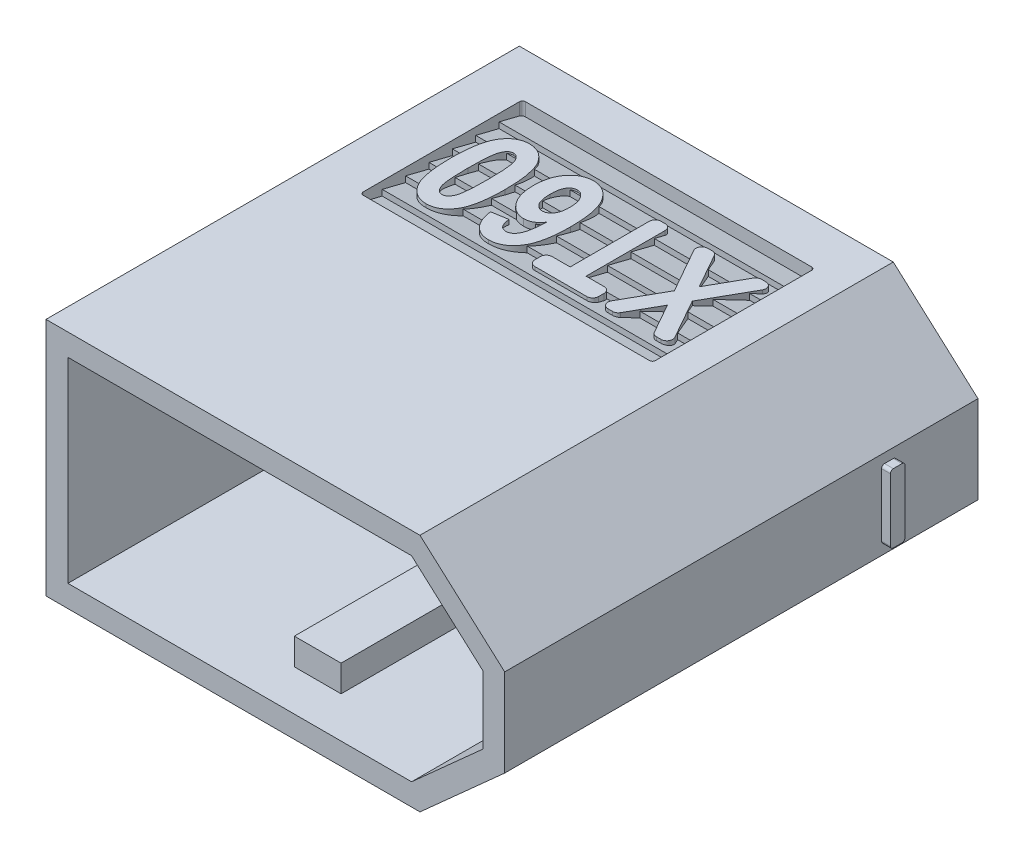
from build123d import *

# Parameters (mm, degrees)
RESSALTO_EXTRUS_O1_DEPTH = 16.2
CORTE_EXTRUS_O1_DEPTH    = 9.4
ESBO_O3_W                = 1.6
ESBO_O3_H                = 0.91
RESSALTO_EXTRUS_O2_DEPTH = 8
ESBO_O4_W                = 1.6
ESBO_O4_H                = 4.7
CORTE_EXTRUS_O2_DEPTH    = 1.5
ESBO_O5_R                = 3
CORTE_EXTRUS_O3_DEPTH    = 2
ESBO_O6_R                = 2.15
CORTE_EXTRUS_O4_DEPTH    = 23.701762046
RESSALTO_EXTRUS_O3_DEPTH = 0.3
RESSALTO_EXTRUS_O4_DEPTH = 0.3
CORTE_EXTRUS_O5_DEPTH    = 0.75
RESSALTO_EXTRUS_O7_REACH = 25.143
RESSALTO_EXTRUS_O8_DEPTH = 0.3
RESSALTO_EXTRUS_O9_DEPTH = 0.3


with BuildPart() as part:
    # Esboço1 → Ressalto-extrusão1 (new body)
    with BuildSketch(Plane.XY):
        Polygon((0, 0), (12.8, 0), (15.7, 2.6), (15.7, 5.6), (12.8, 8.2), (0, 8.2), align=None)
    extrude(amount=RESSALTO_EXTRUS_O1_DEPTH)

    # Esboço2 → Corte-extrusão1 (cut)
    with BuildSketch(Plane.XY.offset(16.2)):
        Polygon((0.75, 7.45), (0.75, 0.75), (12.513018725, 0.75), (14.95, 2.934879763), (14.95, 5.265120237), (12.513018725, 7.45), align=None)
    extrude(amount=-CORTE_EXTRUS_O1_DEPTH, mode=Mode.SUBTRACT)

    # Esboço3 → Ressalto-extrusão2 (add)
    with BuildSketch(Plane.XY.offset(6.8)):
        with Locations((7.9, 1.205)):
            Rectangle(ESBO_O3_W, ESBO_O3_H)
    extrude(amount=RESSALTO_EXTRUS_O2_DEPTH)

    # Esboço4 → Corte-extrusão2 (cut)
    with BuildSketch(Plane.XY.offset(6.8)):
        with Locations((7.9, 4.1)):
            Rectangle(ESBO_O4_W, ESBO_O4_H)
    extrude(amount=-CORTE_EXTRUS_O2_DEPTH, mode=Mode.SUBTRACT)

    # Esboço5 → Corte-extrusão3 (cut)
    with BuildSketch(Plane(origin=(0, 0, 0), x_dir=(-1, 0, 0), z_dir=(0, 0, -1))):
        with Locations((-11.35, 4.1)):
            Circle(ESBO_O5_R)
        with Locations((-4.25, 4.1)):
            Circle(ESBO_O5_R)
    extrude(amount=-CORTE_EXTRUS_O3_DEPTH, mode=Mode.SUBTRACT)

    # Esboço6 → Corte-extrusão4 (cut, through all)
    with BuildSketch(Plane(origin=(0, 0, 2), x_dir=(-1, 0, 0), z_dir=(0, 0, -1))):
        with Locations((-11.35, 4.1)):
            Circle(ESBO_O6_R)
        with Locations((-4.25, 4.1)):
            Circle(ESBO_O6_R)
    extrude(amount=-CORTE_EXTRUS_O4_DEPTH, mode=Mode.SUBTRACT)

    # Esboço7 → Ressalto-extrusão3 (add)
    with BuildSketch(Plane.ZY):
        with BuildLine():
            Line((2.8, 4.35), (2.05, 4.35))
            ThreePointArc((2.05, 4.35), (1.979289322, 4.320710678), (1.95, 4.25))
            Line((1.95, 4.25), (1.95, 3.95))
            ThreePointArc((1.95, 3.95), (1.979289322, 3.879289322), (2.05, 3.85))
            Line((2.05, 3.85), (2.8, 3.85))
            ThreePointArc((2.8, 3.85), (2.870710678, 3.820710678), (2.9, 3.75))
            Line((2.9, 3.75), (2.9, 3))
            ThreePointArc((2.9, 3), (2.929289322, 2.929289322), (3, 2.9))
            Line((3, 2.9), (3.3, 2.9))
            ThreePointArc((3.3, 2.9), (3.370710678, 2.929289322), (3.4, 3))
            Line((3.4, 3), (3.4, 3.75))
            ThreePointArc((3.4, 3.75), (3.429289322, 3.820710678), (3.5, 3.85))
            Line((3.5, 3.85), (4.25, 3.85))
            ThreePointArc((4.25, 3.85), (4.320710678, 3.879289322), (4.35, 3.95))
            Line((4.35, 3.95), (4.35, 4.25))
            ThreePointArc((4.35, 4.25), (4.320710678, 4.320710678), (4.25, 4.35))
            Line((4.25, 4.35), (3.5, 4.35))
            ThreePointArc((3.5, 4.35), (3.429289322, 4.379289322), (3.4, 4.45))
            Line((3.4, 4.45), (3.4, 5.2))
            ThreePointArc((3.4, 5.2), (3.370710678, 5.270710678), (3.3, 5.3))
            Line((3.3, 5.3), (3, 5.3))
            ThreePointArc((3, 5.3), (2.929289322, 5.270710678), (2.9, 5.2))
            Line((2.9, 5.2), (2.9, 4.45))
            ThreePointArc((2.9, 4.45), (2.870710678, 4.379289322), (2.8, 4.35))
        make_face()
    extrude(amount=RESSALTO_EXTRUS_O3_DEPTH)

    # Esboço8 → Ressalto-extrusão4 (add)
    with BuildSketch(Plane(origin=(15.7, 0, 0), x_dir=(0, 0, -1), z_dir=(1, 0, 0))):
        with BuildLine():
            Line((-3.2, 2.925), (-2.9, 2.925))
            ThreePointArc((-2.9, 2.925), (-2.829289322, 2.954289322), (-2.8, 3.025))
            Line((-2.8, 3.025), (-2.8, 5.175))
            ThreePointArc((-2.8, 5.175), (-2.829289322, 5.245710678), (-2.9, 5.275))
            Line((-2.9, 5.275), (-3.2, 5.275))
            ThreePointArc((-3.2, 5.275), (-3.270710678, 5.245710678), (-3.3, 5.175))
            Line((-3.3, 5.175), (-3.3, 3.025))
            ThreePointArc((-3.3, 3.025), (-3.270710678, 2.954289322), (-3.2, 2.925))
        make_face()
    extrude(amount=RESSALTO_EXTRUS_O4_DEPTH)

    # Esboço9 → Corte-extrusão5 (cut)
    with BuildSketch(Plane.XZ):
        with BuildLine():
            Line((1.75, 7.093123445), (11.55, 7.093123445))
            ThreePointArc((11.55, 7.093123445), (11.620710678, 7.063834123), (11.65, 6.993123445))
            Line((11.65, 6.993123445), (11.65, 1.643123445))
            ThreePointArc((11.65, 1.643123445), (11.620710678, 1.572412766), (11.55, 1.543123445))
            Line((11.55, 1.543123445), (1.75, 1.543123445))
            ThreePointArc((1.75, 1.543123445), (1.679289322, 1.572412766), (1.65, 1.643123445))
            Line((1.65, 1.643123445), (1.65, 6.993123445))
            ThreePointArc((1.65, 6.993123445), (1.679289322, 7.063834123), (1.75, 7.093123445))
        make_face()
    corte_extrus_o5 = extrude(amount=-CORTE_EXTRUS_O5_DEPTH, mode=Mode.SUBTRACT)

    # Ressalto-extrusão7: up to this face of the body (flat: up to its plane)
    ressalto_extrus_o7_end = Plane(part.part.faces().sort_by_distance((11.65, 0.375, 4.318123445))[0])
    # Esboço10 → Ressalto-extrusão7 (add, up to the picked face)
    with BuildSketch(Plane(origin=(1.65, 0, 0), x_dir=(0, 0, -1), z_dir=(1, 0, 0)), mode=Mode.PRIVATE) as ressalto_extrus_o7_sk1:
        Polygon((-3.143123445, 0.45), (-3.143123445, 0.25), (-2.343123445, 0.45), (-2.343123445, 0.25), (-1.543123445, 0.45), (-1.543123445, 0.75), (-7.143123445, 0.75), (-7.143123445, 0.45), (-7.143123445, 0.25), (-6.343123445, 0.45), (-6.343123445, 0.25), (-5.543123445, 0.45), (-5.543123445, 0.25), (-4.743123445, 0.45), (-4.743123445, 0.25), (-3.943123445, 0.45), (-3.943123445, 0.25), align=None)
    ressalto_extrus_o7_tool1 = split(extrude(ressalto_extrus_o7_sk1.sketch, amount=RESSALTO_EXTRUS_O7_REACH, mode=Mode.PRIVATE), bisect_by=ressalto_extrus_o7_end, keep=Keep.BOTH, mode=Mode.PRIVATE)
    ressalto_extrus_o7 = ressalto_extrus_o7_tool1.solids().sort_by(Axis((1.65, 0.545833, 4.376457), (1, 0, 0)))[0]
    add(ressalto_extrus_o7)

    # Espelhar1: Corte-extrusão5, Ressalto-extrusão7 across plane
    add(corte_extrus_o5.mirror(Plane.ZX.offset(4.1)), mode=Mode.SUBTRACT)
    add(ressalto_extrus_o7.mirror(Plane.ZX.offset(4.1)))

    # Esboço11 → Ressalto-extrusão8 (add)
    with BuildSketch(Plane(origin=(0, 0.5, 0), x_dir=(-1, 0, 0), z_dir=(0, -1, 0))):
        with BuildLine():
            add(Edge.make_bspline(
                [(-5.023961169, -6.00435038), (-5.023731287, -5.995665006), (-5.023167139, -5.974350412), (-5.020606597, -5.937326865), (-5.015634685, -5.891913541), (-5.008374694, -5.840781928), (-4.996852924, -5.786628833), (-4.98507998, -5.730621834), (-4.970342979, -5.676032154), (-4.952923205, -5.625615372), (-4.932961076, -5.58080345), (-4.908069139, -5.546064886), (-4.881021, -5.518802059), (-4.858555504, -5.515226002), (-4.848332577, -5.513598717)],
                knots=[0, 0, 0, 0, 0.571173607, 1.401705031, 2.438868434, 3.574367159, 4.795071872, 6.077422199, 7.33722776, 8.507872236, 9.587019565, 10.5375099, 11.334493681, 12, 12, 12, 12], degree=3))
            Line((-4.848332577, -5.513598717), (-4.020609309, -5.513598717))
            Line((-4.020609309, -5.513598717), (-3.49036222, -2.555643484))
            add(Edge.make_bspline(
                [(-3.49036222, -2.555643484), (-3.487094486, -2.546511208), (-3.480493928, -2.528064751), (-3.462940698, -2.502333792), (-3.435671591, -2.480838398), (-3.397551986, -2.465314687), (-3.349369795, -2.453459182), (-3.289027368, -2.44320829), (-3.214317598, -2.436547775), (-3.159289179, -2.436398815), (-3.129021098, -2.436316881)],
                knots=[0, 0, 0, 0, 0.572152175, 1.155701031, 1.815395622, 2.59412663, 3.570478222, 4.74694284, 6.210673715, 8, 8, 8, 8], degree=3))
            add(Edge.make_bspline(
                [(-3.129021098, -2.436316881), (-3.099590319, -2.436400624), (-3.045954651, -2.43655324), (-2.973504555, -2.44319605), (-2.916339343, -2.453001646), (-2.873392308, -2.464895138), (-2.841745516, -2.480373872), (-2.823600732, -2.503205048), (-2.815413627, -2.529106558), (-2.817188659, -2.546643114), (-2.818099667, -2.555643484)],
                knots=[0, 0, 0, 0, 1.887972692, 3.440706659, 4.664361098, 5.602810567, 6.303007865, 6.878566498, 7.424441367, 8, 8, 8, 8], degree=3))
            Line((-2.818099667, -2.555643484), (-3.348346756, -5.513598717))
            Line((-3.348346756, -5.513598717), (-2.527346113, -5.513598717))
            add(Edge.make_bspline(
                [(-2.527346113, -5.513598717), (-2.5158995, -5.51461475), (-2.493831667, -5.516573553), (-2.472715893, -5.546733002), (-2.463160736, -5.584517711), (-2.462285798, -5.613492933), (-2.461800514, -5.629564007)],
                knots=[0, 0, 0, 0, 0.876044977, 1.688920123, 2.718162199, 4, 4, 4, 4], degree=3))
            add(Edge.make_bspline(
                [(-2.461800514, -5.629564007), (-2.461977539, -5.638813278), (-2.462407487, -5.661277307), (-2.466216965, -5.699071845), (-2.470998184, -5.745356077), (-2.478414587, -5.796958197), (-2.488582941, -5.852446205), (-2.500798033, -5.908853075), (-2.514928426, -5.964134452), (-2.534662336, -6.013696946), (-2.55458049, -6.057861337), (-2.578178377, -6.092213603), (-2.605428151, -6.117627625), (-2.627240684, -6.121178211), (-2.637429106, -6.122836655)],
                knots=[0, 0, 0, 0, 0.605043227, 1.469489812, 2.48341245, 3.649686645, 4.879047589, 6.17309233, 7.426799419, 8.604393452, 9.661770922, 10.582105409, 11.337715268, 12, 12, 12, 12], degree=3))
            Line((-2.637429106, -6.122836655), (-4.960096227, -6.122836655))
            add(Edge.make_bspline(
                [(-4.960096227, -6.122836655), (-4.969934281, -6.121426251), (-4.99037917, -6.118495228), (-5.011571026, -6.089692698), (-5.021864767, -6.050856537), (-5.023211361, -6.020983972), (-5.023961169, -6.00435038)],
                knots=[0, 0, 0, 0, 0.771159906, 1.602580858, 2.665073155, 4, 4, 4, 4], degree=3))
        make_face()
        with BuildLine():
            add(Edge.make_bspline(
                [(-8.005445591, -5.732084047), (-8.005233805, -5.721157588), (-8.004755518, -5.69648183), (-8.002257862, -5.656087157), (-7.997216524, -5.609824927), (-7.989672588, -5.559640101), (-7.979672262, -5.507819052), (-7.968127736, -5.455855322), (-7.954624636, -5.406442246), (-7.937593996, -5.361995207), (-7.919841845, -5.322908562), (-7.899498565, -5.292757131), (-7.878287508, -5.269109619), (-7.86042282, -5.265583769), (-7.852505861, -5.264021244)],
                knots=[0, 0, 0, 0, 0.766224037, 1.73040148, 2.836554055, 4.028156414, 5.287742343, 6.536100283, 7.760906599, 8.873491865, 9.874955351, 10.751978432, 11.446923712, 12, 12, 12, 12], degree=3))
            add(Edge.make_bspline(
                [(-7.852505861, -5.264021244), (-7.845452061, -5.264904506), (-7.829851748, -5.266857944), (-7.804797296, -5.276024895), (-7.776406148, -5.29162043), (-7.730609729, -5.322094595), (-7.661287561, -5.366554766), (-7.562598175, -5.424293206), (-7.440427841, -5.481447336), (-7.322385437, -5.522805842), (-7.215484092, -5.550613186), (-7.125251104, -5.565599411), (-7.027726856, -5.57352652), (-6.960370911, -5.575015091), (-6.925623866, -5.575783003)],
                knots=[0, 0, 0, 0, 0.256781181, 0.567901939, 0.958081965, 1.427920935, 2.558951999, 3.940235169, 5.564546954, 7.434602361, 8.460374185, 9.560843022, 10.741707222, 12, 12, 12, 12], degree=3))
            add(Edge.make_bspline(
                [(-6.925623866, -5.575783003), (-6.890276179, -5.575112001), (-6.820714939, -5.573791525), (-6.71881609, -5.559310648), (-6.620879787, -5.539244265), (-6.528038512, -5.508289798), (-6.439439434, -5.470183053), (-6.354808917, -5.425881372), (-6.274209796, -5.374938124), (-6.197898312, -5.317782161), (-6.125337935, -5.254656842), (-6.057780279, -5.185519577), (-5.993086757, -5.112490516), (-5.915245473, -5.00655333), (-5.827853488, -4.865004138), (-5.741758712, -4.683337999), (-5.673142777, -4.492613249), (-5.626520902, -4.295160578), (-5.595410147, -4.096109002), (-5.592019032, -3.96274579), (-5.59034237, -3.896807277)],
                knots=[0, 0, 0, 0, 0.80118641, 1.5766667, 2.33060899, 3.065984097, 3.79180022, 4.516503127, 5.230402579, 5.952175127, 6.677184339, 7.409506429, 8.143480375, 8.888129179, 10.388673858, 11.909102309, 13.440443778, 14.976838324, 16.505264068, 18, 18, 18, 18], degree=3))
            add(Edge.make_bspline(
                [(-5.59034237, -3.896807277), (-5.590871805, -3.861481942), (-5.591899808, -3.792890748), (-5.603110001, -3.693712719), (-5.620667577, -3.601229886), (-5.644851035, -3.51534807), (-5.675878531, -3.435840868), (-5.713888363, -3.363292733), (-5.757702979, -3.297278928), (-5.807513278, -3.237950776), (-5.863357452, -3.185891772), (-5.924157557, -3.139448548), (-5.992135639, -3.102310572), (-6.064487022, -3.070033176), (-6.14190109, -3.044779053), (-6.224178948, -3.027460146), (-6.310743564, -3.016057319), (-6.370129331, -3.015001296), (-6.400418746, -3.014462676)],
                knots=[0, 0, 0, 0, 1.245481004, 2.418350133, 3.515051619, 4.562728981, 5.560783658, 6.519734471, 7.445909044, 8.350382342, 9.245035617, 10.134216955, 11.041061373, 11.969972066, 12.926017502, 13.906558924, 14.932250809, 16, 16, 16, 16], degree=3))
            add(Edge.make_bspline(
                [(-6.400418746, -3.014462676), (-6.441984642, -3.015611215), (-6.525415258, -3.017916548), (-6.647858981, -3.041043496), (-6.766205581, -3.074435661), (-6.838672757, -3.110262009), (-6.874363846, -3.127906982)],
                knots=[0, 0, 0, 0, 1.012553476, 2.032386399, 3.030923011, 4, 4, 4, 4], degree=3))
            Line((-6.874363846, -3.127906982), (-7.027303577, -3.975798127))
            Line((-7.027303577, -3.975798127), (-6.405460715, -3.975798127))
            add(Edge.make_bspline(
                [(-6.405460715, -3.975798127), (-6.396032338, -3.977054064), (-6.376498001, -3.979656199), (-6.354225524, -4.004786531), (-6.340822506, -4.042285405), (-6.340248828, -4.071973018), (-6.339915116, -4.089242433)],
                knots=[0, 0, 0, 0, 0.76021162, 1.575056727, 2.589399796, 4, 4, 4, 4], degree=3))
            add(Edge.make_bspline(
                [(-6.339915116, -4.089242433), (-6.340007123, -4.100178481), (-6.34021529, -4.124921501), (-6.345257389, -4.164911883), (-6.350408738, -4.210435976), (-6.359386856, -4.258457362), (-6.368207285, -4.308513896), (-6.379561212, -4.358263352), (-6.393351556, -4.406000103), (-6.410607636, -4.448661231), (-6.431034, -4.484869643), (-6.451535593, -4.514643738), (-6.476695242, -4.535852891), (-6.496191515, -4.539001749), (-6.50545977, -4.540498671)],
                knots=[0, 0, 0, 0, 0.777619142, 1.759378421, 2.864503789, 4.037640318, 5.233916541, 6.481404614, 7.667005543, 8.766363746, 9.747920663, 10.616982492, 11.342532841, 12, 12, 12, 12], degree=3))
            Line((-6.50545977, -4.540498671), (-7.618054295, -4.540498671))
            add(Edge.make_bspline(
                [(-7.618054295, -4.540498671), (-7.631028748, -4.539695256), (-7.655886414, -4.538155997), (-7.690371762, -4.526433837), (-7.718598065, -4.50614808), (-7.74018276, -4.478209964), (-7.754374786, -4.44306982), (-7.760248857, -4.401532584), (-7.761457637, -4.353981025), (-7.756174688, -4.320568781), (-7.753347134, -4.302685793)],
                knots=[0, 0, 0, 0, 0.968467303, 1.855479917, 2.680305945, 3.530243379, 4.459230605, 5.47774572, 6.650032557, 8, 8, 8, 8], degree=3))
            Line((-7.753347134, -4.302685793), (-7.488643754, -2.832951787))
            add(Edge.make_bspline(
                [(-7.488643754, -2.832951787), (-7.484932567, -2.816378345), (-7.478008418, -2.785456437), (-7.46492174, -2.741793185), (-7.446178544, -2.7041663), (-7.430134023, -2.682328748), (-7.422257827, -2.671608774)],
                knots=[0, 0, 0, 0, 1.156316651, 2.157398464, 3.095473648, 4, 4, 4, 4], degree=3))
            add(Edge.make_bspline(
                [(-7.422257827, -2.671608774), (-7.416231591, -2.665574456), (-7.402120311, -2.651444251), (-7.37426183, -2.631630505), (-7.336320112, -2.612116828), (-7.271721396, -2.580005779), (-7.173655195, -2.540224112), (-7.038673137, -2.495401693), (-6.884344834, -2.453408859), (-6.714006485, -2.419933315), (-6.533346086, -2.394808927), (-6.409750166, -2.392235662), (-6.34747807, -2.390939158)],
                knots=[0, 0, 0, 0, 0.226925493, 0.53137799, 0.905335483, 1.362486358, 2.452980185, 3.720011825, 5.149871189, 6.709721602, 8.342238718, 10, 10, 10, 10], degree=3))
            add(Edge.make_bspline(
                [(-6.34747807, -2.390939158), (-6.290017279, -2.392085578), (-6.17847988, -2.394310898), (-6.016534188, -2.41097196), (-5.865393213, -2.439681829), (-5.724343707, -2.47847325), (-5.594644173, -2.53031849), (-5.474482576, -2.59117225), (-5.366924212, -2.665978248), (-5.269134234, -2.750285511), (-5.183278961, -2.846044213), (-5.107514929, -2.951618377), (-5.045184949, -3.068619941), (-4.991498741, -3.194272892), (-4.950571377, -3.330444745), (-4.92155039, -3.476194463), (-4.903510692, -3.631932588), (-4.901479969, -3.739054811), (-4.900432925, -3.794287238)],
                knots=[0, 0, 0, 0, 1.198820216, 2.327035275, 3.391905235, 4.405853918, 5.373943326, 6.301912563, 7.209749437, 8.100436241, 8.990125377, 9.886946289, 10.804904538, 11.750377292, 12.733955993, 13.765538726, 14.847907423, 16, 16, 16, 16], degree=3))
            add(Edge.make_bspline(
                [(-4.900432925, -3.794287238), (-4.900905574, -3.845294829), (-4.901844387, -3.946610285), (-4.914742729, -4.097966778), (-4.932583422, -4.247805266), (-4.958701667, -4.395928796), (-4.99253789, -4.541087834), (-5.032356058, -4.683657708), (-5.081529457, -4.821948844), (-5.13678848, -4.956828646), (-5.199584663, -5.086811605), (-5.270198263, -5.211779027), (-5.345934724, -5.33288119), (-5.430056432, -5.447884454), (-5.521068083, -5.55643969), (-5.618182845, -5.658754515), (-5.724187844, -5.75176642), (-5.835355528, -5.838862544), (-5.954599059, -5.916135709), (-6.079758992, -5.985133465), (-6.211692275, -6.045266744), (-6.350247896, -6.095365279), (-6.495259856, -6.136376965), (-6.647191877, -6.164275874), (-6.805564122, -6.182714335), (-6.913525434, -6.184799742), (-6.968480603, -6.18586127)],
                knots=[0, 0, 0, 0, 1.038419447, 2.062593738, 3.091332759, 4.110730389, 5.12359561, 6.125738619, 7.123390902, 8.110666656, 9.092886964, 10.060808202, 11.032487199, 12.000004954, 12.959688702, 13.915839818, 14.869418181, 15.828983254, 16.789344864, 17.759482257, 18.737170252, 19.738663678, 20.757278993, 21.802195652, 22.881259323, 24, 24, 24, 24], degree=3))
            add(Edge.make_bspline(
                [(-6.968480603, -6.18586127), (-7.0290792, -6.184331494), (-7.147145904, -6.18135097), (-7.317412746, -6.155941012), (-7.473193069, -6.119872726), (-7.612804056, -6.077894875), (-7.732975101, -6.029341039), (-7.819588267, -5.98510127), (-7.876269531, -5.949103523), (-7.909395725, -5.926063462), (-7.935436602, -5.907072311), (-7.960438269, -5.88640523), (-7.981066611, -5.858738461), (-7.997461203, -5.821981054), (-8.004140504, -5.77910018), (-8.004986589, -5.74861974), (-8.005445591, -5.732084047)],
                knots=[0, 0, 0, 0, 2.087911378, 4.067962421, 5.920740836, 7.59756473, 9.087613358, 10.383270069, 10.94314657, 11.401166784, 11.773890065, 12.054576704, 12.51614555, 12.948510593, 13.429565086, 14, 14, 14, 14], degree=3))
        make_face()
        with BuildLine():
            Line((-9.699547225, -3.845547257), (-9.470137629, -2.552282171))
            add(Edge.make_bspline(
                [(-9.470137629, -2.552282171), (-9.466859766, -2.543161727), (-9.460238748, -2.52473917), (-9.442946515, -2.498964908), (-9.414937846, -2.478219246), (-9.376716334, -2.463027083), (-9.328197381, -2.450399387), (-9.267224842, -2.442997509), (-9.192960802, -2.436667812), (-9.138508583, -2.436440768), (-9.108796506, -2.436316881)],
                knots=[0, 0, 0, 0, 0.573468519, 1.15835994, 1.80927796, 2.60501552, 3.583613393, 4.774068884, 6.239757445, 8, 8, 8, 8], degree=3))
            add(Edge.make_bspline(
                [(-9.108796506, -2.436316881), (-9.07908089, -2.4364132), (-9.025460301, -2.436587003), (-8.953170251, -2.442958428), (-8.895984093, -2.450121251), (-8.853113738, -2.462392488), (-8.821882373, -2.47787117), (-8.803149573, -2.499931887), (-8.795230917, -2.525777934), (-8.796978272, -2.543292888), (-8.797875076, -2.552282171)],
                knots=[0, 0, 0, 0, 1.911024314, 3.448363529, 4.669437815, 5.610387303, 6.312449918, 6.875579012, 7.422908085, 8, 8, 8, 8], degree=3))
            Line((-8.797875076, -2.552282171), (-9.027284672, -3.845547257))
            Line((-9.027284672, -3.845547257), (-8.486953645, -5.845528352))
            add(Edge.make_bspline(
                [(-8.486953645, -5.845528352), (-8.478833829, -5.87511468), (-8.464477661, -5.927424524), (-8.452459229, -5.997552522), (-8.451114009, -6.053647581), (-8.470343992, -6.090049885), (-8.495365993, -6.108483462), (-8.519933136, -6.118787125), (-8.549846675, -6.127196016), (-8.58564508, -6.132928512), (-8.62837865, -6.135711651), (-8.678523457, -6.13827363), (-8.736802258, -6.139884763), (-8.778266582, -6.140275181), (-8.80039606, -6.140483547)],
                knots=[0, 0, 0, 0, 1.871476962, 3.308848235, 4.353767051, 5.234513845, 5.686208054, 6.229944972, 6.852727002, 7.581222775, 8.43941278, 9.467243455, 10.648269802, 12, 12, 12, 12], degree=3))
            add(Edge.make_bspline(
                [(-8.80039606, -6.140483547), (-8.832318453, -6.140341829), (-8.888907188, -6.140090606), (-8.964273956, -6.138021895), (-9.021780456, -6.129917263), (-9.066180039, -6.120808034), (-9.098903106, -6.102781231), (-9.120223894, -6.076561798), (-9.13175067, -6.04348518), (-9.138106211, -6.019785287), (-9.141569306, -6.006871365)],
                knots=[0, 0, 0, 0, 1.872853804, 3.32000257, 4.414278968, 5.278892846, 5.96356431, 6.558835249, 7.214718403, 8, 8, 8, 8], degree=3))
            Line((-9.141569306, -6.006871365), (-9.363415948, -5.124526764))
            add(Edge.make_bspline(
                [(-9.363415948, -5.124526764), (-9.375252204, -5.073003414), (-9.398319243, -4.972592338), (-9.4313429, -4.82328113), (-9.459458724, -4.674488444), (-9.474906837, -4.574439649), (-9.482742551, -4.523692108)],
                knots=[0, 0, 0, 0, 1.035280845, 2.017602979, 2.994472888, 4, 4, 4, 4], degree=3))
            Line((-9.482742551, -4.523692108), (-9.487784521, -4.523692108))
            add(Edge.make_bspline(
                [(-9.487784521, -4.523692108), (-9.511639997, -4.574225455), (-9.559347354, -4.675284529), (-9.635013885, -4.824621142), (-9.714451456, -4.972922929), (-9.770445333, -5.070325057), (-9.798705951, -5.119484795)],
                knots=[0, 0, 0, 0, 0.997419509, 1.994688626, 2.987901158, 4, 4, 4, 4], degree=3))
            Line((-9.798705951, -5.119484795), (-10.326432055, -6.015274647))
            add(Edge.make_bspline(
                [(-10.326432055, -6.015274647), (-10.333247008, -6.02658162), (-10.346131701, -6.047959155), (-10.367813932, -6.077469508), (-10.397293269, -6.100071343), (-10.435252647, -6.11659373), (-10.484479232, -6.127846444), (-10.547170712, -6.136190535), (-10.628360793, -6.139453445), (-10.688895234, -6.140111868), (-10.723066962, -6.140483547)],
                knots=[0, 0, 0, 0, 0.717854675, 1.357212346, 1.975202924, 2.710745717, 3.589209825, 4.710534674, 6.143094915, 8, 8, 8, 8], degree=3))
            add(Edge.make_bspline(
                [(-10.723066962, -6.140483547), (-10.746315279, -6.140244969), (-10.789737126, -6.139799365), (-10.850571208, -6.138566379), (-10.902659649, -6.134868561), (-10.946544735, -6.131420338), (-10.982700322, -6.124853597), (-11.011731032, -6.115530144), (-11.035346625, -6.104645101), (-11.05126765, -6.088522037), (-11.061638069, -6.069687635), (-11.063660752, -6.047269133), (-11.058519319, -6.022504265), (-11.043126489, -5.98211466), (-11.009623355, -5.922933123), (-10.97952139, -5.87342411), (-10.962560496, -5.845528352)],
                knots=[0, 0, 0, 0, 1.604706746, 2.9971774, 4.198278929, 5.208200935, 6.034760513, 6.725606941, 7.313579332, 7.805702227, 8.264006837, 8.76998451, 9.319854892, 9.998695175, 11.74547258, 14, 14, 14, 14], degree=3))
            Line((-10.962560496, -5.845528352), (-9.699547225, -3.845547257))
        make_face()
    extrude(amount=RESSALTO_EXTRUS_O8_DEPTH)

    # Esboço12 → Ressalto-extrusão9 (add)
    # profile 1 of 4: a face of its own
    with BuildSketch(Plane(origin=(0, 7.7, 0), x_dir=(1, 0, 0), z_dir=(0, 1, 0))):
        with BuildLine():
            Line((11.185044584, -2.866454717), (10.320104725, -4.398379126))
            Line((10.320104725, -4.398379126), (11.094198639, -5.769814539))
            ThreePointArc((11.094198639, -5.769814539), (11.092744365, -5.968965447), (10.920028151, -6.068123445))
            Line((10.920028151, -6.068123445), (10.7649422, -6.068123445))
            ThreePointArc((10.7649422, -6.068123445), (10.664138477, -6.040862003), (10.590815302, -5.966509539))
            Line((10.590815302, -5.966509539), (10.012576316, -4.943123445))
            Line((10.012576316, -4.943123445), (9.435030455, -5.966426179))
            ThreePointArc((9.435030455, -5.966426179), (9.361701545, -6.040837872), (9.260856483, -6.068123445))
            Line((9.260856483, -6.068123445), (9.105124481, -6.068123445))
            ThreePointArc((9.105124481, -6.068123445), (8.932408267, -5.968965447), (8.930953993, -5.769814539))
            Line((8.930953993, -5.769814539), (9.705047907, -4.398379126))
            Line((9.705047907, -4.398379126), (8.840108048, -2.866454717))
            ThreePointArc((8.840108048, -2.866454717), (8.841543221, -2.667292533), (9.01426591, -2.568123445))
            Line((9.01426591, -2.568123445), (9.169940798, -2.568123445))
            ThreePointArc((9.169940798, -2.568123445), (9.270790107, -2.595411497), (9.344119604, -2.669829276))
            Line((9.344119604, -2.669829276), (10.012576316, -3.854345035))
            Line((10.012576316, -3.854345035), (10.681728288, -2.669756355))
            ThreePointArc((10.681728288, -2.669756355), (10.755052773, -2.595390388), (10.855865922, -2.568123445))
            Line((10.855865922, -2.568123445), (11.010886722, -2.568123445))
            ThreePointArc((11.010886722, -2.568123445), (11.183609411, -2.667292533), (11.185044584, -2.866454717))
        make_face()
    # profile 2 of 4: a face of its own
    with BuildSketch(Plane(origin=(0, 7.7, 0), x_dir=(1, 0, 0), z_dir=(0, 1, 0))):
        with BuildLine():
            Line((7.762576316, -2.768123445), (7.762576316, -5.477214354))
            Line((7.762576316, -5.477214354), (8.380758134, -5.477214354))
            ThreePointArc((8.380758134, -5.477214354), (8.522179491, -5.535792997), (8.580758134, -5.677214354))
            Line((8.580758134, -5.677214354), (8.580758134, -5.868123445))
            ThreePointArc((8.580758134, -5.868123445), (8.522179491, -6.009544801), (8.380758134, -6.068123445))
            Line((8.380758134, -6.068123445), (6.598939953, -6.068123445))
            ThreePointArc((6.598939953, -6.068123445), (6.457518596, -6.009544801), (6.398939953, -5.868123445))
            Line((6.398939953, -5.868123445), (6.398939953, -5.677214354))
            ThreePointArc((6.398939953, -5.677214354), (6.457518596, -5.535792997), (6.598939953, -5.477214354))
            Line((6.598939953, -5.477214354), (7.217121771, -5.477214354))
            Line((7.217121771, -5.477214354), (7.217121771, -2.768123445))
            ThreePointArc((7.217121771, -2.768123445), (7.275700414, -2.626702088), (7.417121771, -2.568123445))
            Line((7.417121771, -2.568123445), (7.562576316, -2.568123445))
            ThreePointArc((7.562576316, -2.568123445), (7.703997672, -2.626702088), (7.762576316, -2.768123445))
        make_face()
    # profile 3 of 4: a face of its own
    with BuildSketch(Plane(origin=(0, 7.7, 0), x_dir=(1, 0, 0), z_dir=(0, 1, 0))):
        with BuildLine():
            Line((4.217121771, -5.204487081), (4.762576316, -5.11357799))
            add(Edge.make_bspline(
                [(4.762576316, -5.11357799), (4.76820949, -5.173924633), (4.781337444, -5.259439061), (4.819168165, -5.361191101), (4.853361229, -5.419789109), (4.894424887, -5.466597978), (4.961777465, -5.510957772), (5.022038471, -5.523265851), (5.062292225, -5.522668899)],
                knots=[0, 0, 0, 0, 0.323351038, 0.457031878, 0.575725889, 0.682827962, 0.785621923, 1, 1, 1, 1], degree=3))
            add(Edge.make_bspline(
                [(5.062292225, -5.522668899), (5.090005536, -5.523271256), (5.131240753, -5.516505903), (5.183240033, -5.496464747), (5.220091612, -5.475090137), (5.254809063, -5.44738128), (5.287295538, -5.413652015), (5.318784831, -5.374418203), (5.348496948, -5.327992624), (5.375862324, -5.27190132), (5.400526587, -5.204375405), (5.42080653, -5.124170881), (5.441377932, -5.032489264), (5.456741962, -4.927718403), (5.47688134, -4.763925871), (5.485298827, -4.634283794), (5.489849043, -4.543975717)],
                knots=[0, 0, 0, 0, 0.07110629, 0.106432223, 0.14303469, 0.180361233, 0.220458154, 0.263402163, 0.309743564, 0.362096385, 0.423824058, 0.494518004, 0.575001043, 0.665717727, 0.767054977, 1, 1, 1, 1], degree=3))
            add(Edge.make_bspline(
                [(5.489849043, -4.543975717), (5.458325439, -4.59029492), (5.407025482, -4.654615722), (5.327609617, -4.725483765), (5.267100836, -4.768088661), (5.202789438, -4.800226136), (5.112590312, -4.832606749), (5.040111771, -4.83988466), (4.991979725, -4.840850717)],
                knots=[0, 0, 0, 0, 0.277998008, 0.405177954, 0.526602292, 0.643637452, 0.760548992, 1, 1, 1, 1], degree=3))
            add(Edge.make_bspline(
                [(4.991979725, -4.840850717), (4.938397795, -4.840049228), (4.857644594, -4.832427325), (4.755876709, -4.798007625), (4.682335645, -4.763632003), (4.610596897, -4.720231075), (4.542640345, -4.665558625), (4.476889163, -4.601961344), (4.414752476, -4.529006286), (4.357734038, -4.448067208), (4.307371702, -4.360004902), (4.266071161, -4.265189584), (4.230469873, -4.164568314), (4.205010426, -4.057053869), (4.1786726, -3.902079336), (4.170937798, -3.781658743), (4.171667225, -3.69951549)],
                knots=[0, 0, 0, 0, 0.103373273, 0.154207333, 0.205955138, 0.259297376, 0.315055498, 0.373346508, 0.435038939, 0.499094576, 0.56354236, 0.62980043, 0.697776404, 0.768573701, 0.842016383, 1, 1, 1, 1], degree=3))
            add(Edge.make_bspline(
                [(4.171667225, -3.69951549), (4.17185896, -3.612421658), (4.179060828, -3.485146498), (4.205900348, -3.321369203), (4.234396433, -3.20963002), (4.2696034, -3.104366118), (4.314707671, -3.007473367), (4.366288245, -2.916922605), (4.426957594, -2.835664661), (4.492885026, -2.762488286), (4.56321129, -2.698010574), (4.638016826, -2.644053991), (4.716117978, -2.599205297), (4.798442704, -2.564863658), (4.914867128, -2.532610579), (5.005897079, -2.522349793), (5.067263816, -2.522668899)],
                knots=[0, 0, 0, 0, 0.157846943, 0.230497149, 0.300424491, 0.366636184, 0.431332033, 0.493808926, 0.555163499, 0.614703094, 0.672106668, 0.727718583, 0.781520235, 0.834985538, 0.88891022, 1, 1, 1, 1], degree=3))
            add(Edge.make_bspline(
                [(5.067263816, -2.522668899), (5.134776318, -2.522388948), (5.235013241, -2.535219464), (5.362092148, -2.577511404), (5.451550186, -2.622540527), (5.536655096, -2.680446511), (5.616741921, -2.751072456), (5.692332527, -2.834441462), (5.763971124, -2.930110778), (5.82918472, -3.04081959), (5.883929661, -3.168816952), (5.931571611, -3.312472802), (5.969029009, -3.473320865), (5.999665981, -3.650168244), (6.028262771, -3.919162037), (6.035311504, -4.129776969), (6.035303589, -4.275509808)],
                knots=[0, 0, 0, 0, 0.090693495, 0.134685131, 0.179530034, 0.224912922, 0.272737739, 0.322760271, 0.375986421, 0.433203955, 0.495069598, 0.562818628, 0.636478469, 0.716917714, 0.804030531, 1, 1, 1, 1], degree=3))
            add(Edge.make_bspline(
                [(6.035303589, -4.275509808), (6.035321208, -4.423581802), (6.028586042, -4.637939475), (5.997249035, -4.911199563), (5.966641992, -5.091655496), (5.926254815, -5.255456188), (5.877882298, -5.403133674), (5.820063121, -5.534267496), (5.751835344, -5.647887006), (5.677444095, -5.746891367), (5.597624044, -5.832519938), (5.513228762, -5.905957941), (5.422406745, -5.96445997), (5.327623343, -6.011484887), (5.191786058, -6.055622146), (5.084345761, -6.068641489), (5.011866089, -6.068123445)],
                knots=[0, 0, 0, 0, 0.192657569, 0.278521348, 0.357596923, 0.430563241, 0.497752602, 0.559502274, 0.616536619, 0.669746994, 0.720292489, 0.768554988, 0.814846956, 0.860430936, 0.905808517, 1, 1, 1, 1], degree=3))
            add(Edge.make_bspline(
                [(5.011866089, -6.068123445), (4.961903446, -6.06789345), (4.888028114, -6.061626473), (4.793001037, -6.039603881), (4.725795095, -6.016102048), (4.661944049, -5.985106158), (4.600204149, -5.948907027), (4.541772821, -5.905419857), (4.487247773, -5.854566598), (4.43554269, -5.798076733), (4.390262811, -5.733146732), (4.348758109, -5.662053174), (4.313065822, -5.583489418), (4.280538021, -5.498839828), (4.24537643, -5.372392174), (4.226035204, -5.273167916), (4.217121771, -5.204487081)],
                knots=[0, 0, 0, 0, 0.115543302, 0.170649433, 0.225187049, 0.279790566, 0.334525644, 0.390473716, 0.447810616, 0.506730268, 0.567186295, 0.630471054, 0.696846024, 0.766492743, 0.839958973, 1, 1, 1, 1], degree=3))
        make_face()
        with BuildLine():
            add(Edge.make_bspline(
                [(5.444394498, -3.721532535), (5.443413243, -3.671816504), (5.441774499, -3.598919405), (5.428964767, -3.50575196), (5.416513606, -3.442460626), (5.39901126, -3.384318695), (5.379738685, -3.329960639), (5.355461716, -3.280752232), (5.327421984, -3.236743151), (5.298038654, -3.197058094), (5.266817632, -3.162801594), (5.234319039, -3.134257306), (5.201874492, -3.109517602), (5.167408759, -3.090781113), (5.119948206, -3.073930539), (5.082776396, -3.068257967), (5.058030862, -3.068123445)],
                knots=[0, 0, 0, 0, 0.178482482, 0.260708928, 0.336947951, 0.40946762, 0.47821344, 0.543503214, 0.605672981, 0.665087478, 0.720355931, 0.771459165, 0.820010483, 0.866344773, 0.911449985, 1, 1, 1, 1], degree=3))
            add(Edge.make_bspline(
                [(5.058030862, -3.068123445), (5.011333584, -3.067304655), (4.939791649, -3.085797467), (4.86264655, -3.146956505), (4.819952016, -3.197224746), (4.79035383, -3.246363095), (4.770537869, -3.289704134), (4.754443985, -3.338919978), (4.740189246, -3.393143293), (4.729596718, -3.453239822), (4.72052411, -3.544234997), (4.716316659, -3.615360982), (4.717121771, -3.664714354)],
                knots=[0, 0, 0, 0, 0.182717956, 0.277311697, 0.381920987, 0.439334057, 0.501576805, 0.568145713, 0.64192066, 0.721049878, 0.806868135, 1, 1, 1, 1], degree=3))
            add(Edge.make_bspline(
                [(4.717121771, -3.664714354), (4.717023666, -3.715881874), (4.71928254, -3.790108644), (4.731260972, -3.884669406), (4.742289738, -3.947647624), (4.757256441, -4.005038937), (4.774726651, -4.057271853), (4.795918712, -4.103878339), (4.828454634, -4.156184323), (4.87337471, -4.211354153), (4.957448965, -4.275083227), (5.032786713, -4.296660278), (5.082888816, -4.295396172)],
                knots=[0, 0, 0, 0, 0.189207564, 0.273855027, 0.352111634, 0.425324443, 0.49283636, 0.555472207, 0.61399486, 0.72019415, 0.816437051, 1, 1, 1, 1], degree=3))
            add(Edge.make_bspline(
                [(5.082888816, -4.295396172), (5.131526314, -4.295488538), (5.205689597, -4.276323592), (5.287703716, -4.214653218), (5.333020871, -4.162954728), (5.365244164, -4.113471075), (5.386562707, -4.070535517), (5.404216359, -4.023081599), (5.419178051, -3.971365378), (5.430172085, -3.91499019), (5.442161504, -3.831586596), (5.444525217, -3.766315864), (5.444394498, -3.721532535)],
                knots=[0, 0, 0, 0, 0.192976457, 0.293260508, 0.40387877, 0.464412825, 0.527516319, 0.593906739, 0.665362139, 0.741185596, 0.82193725, 1, 1, 1, 1], degree=3))
        make_face(mode=Mode.SUBTRACT)
    # profile 4 of 4: a face of its own
    with BuildSketch(Plane(origin=(0, 7.7, 0), x_dir=(1, 0, 0), z_dir=(0, 1, 0))):
        with BuildLine():
            add(Edge.make_bspline(
                [(2.877633134, -6.068123445), (2.810730433, -6.067849084), (2.711314347, -6.056349671), (2.585994956, -6.0147115), (2.498310016, -5.971140602), (2.415902857, -5.914953241), (2.338568607, -5.846563404), (2.266246061, -5.765980633), (2.198470254, -5.672487326), (2.137564732, -5.563141791), (2.085547014, -5.43597675), (2.041861983, -5.290553015), (2.006259497, -5.126888157), (1.978040904, -4.944750096), (1.951290686, -4.665360773), (1.9446089, -4.446077253), (1.944394498, -4.293975717)],
                knots=[0, 0, 0, 0, 0.089720065, 0.13287086, 0.176439702, 0.220535808, 0.266180481, 0.314487638, 0.365396204, 0.420661105, 0.481833882, 0.5491908, 0.623951051, 0.706174952, 0.796103949, 1, 1, 1, 1], degree=3))
            add(Edge.make_bspline(
                [(1.944394498, -4.293975717), (1.944638719, -4.142353226), (1.951233344, -3.923761612), (1.97812578, -3.645109231), (2.006115325, -3.463394365), (2.042144964, -3.299848), (2.08521413, -3.154455192), (2.137775908, -3.027506965), (2.19840458, -2.918257183), (2.26630614, -2.825073804), (2.337841143, -2.744006751), (2.415214295, -2.675842312), (2.497463758, -2.619864691), (2.584721063, -2.575889294), (2.709503059, -2.534751072), (2.808285478, -2.522615935), (2.874792225, -2.522668899)],
                knots=[0, 0, 0, 0, 0.20374449, 0.293570465, 0.37598958, 0.450616808, 0.518437924, 0.579462338, 0.634858447, 0.685887879, 0.734097166, 0.779850207, 0.824051004, 0.867438546, 0.910691788, 1, 1, 1, 1], degree=3))
            add(Edge.make_bspline(
                [(2.874792225, -2.522668899), (2.941484266, -2.523710824), (3.041281588, -2.533299712), (3.166214895, -2.575602655), (3.254335121, -2.618030045), (3.336271187, -2.674506287), (3.413868558, -2.742018188), (3.486229751, -2.821916845), (3.541301575, -2.897840806), (3.58269805, -2.96498955), (3.611578144, -3.021150661), (3.638494695, -3.081976307), (3.664404568, -3.147121215), (3.686601305, -3.217861571), (3.708035904, -3.292850452), (3.727138607, -3.372484959), (3.744019269, -3.456881892), (3.759963805, -3.545815866), (3.772136852, -3.639993555), (3.784042777, -3.73839755), (3.79197113, -3.841982247), (3.799364724, -3.949918137), (3.805668325, -4.103578693), (3.808979936, -4.221020489), (3.808030862, -4.30107799)],
                knots=[0, 0, 0, 0, 0.089417833, 0.132451122, 0.17576164, 0.219737665, 0.265049642, 0.312990798, 0.36350462, 0.390208605, 0.418376443, 0.447842402, 0.479107586, 0.512034425, 0.546898156, 0.583358489, 0.621466834, 0.661945644, 0.704106633, 0.74838679, 0.794432191, 0.842955807, 0.893007524, 1, 1, 1, 1], degree=3))
            add(Edge.make_bspline(
                [(3.808030862, -4.30107799), (3.807817856, -4.452232991), (3.801141288, -4.670100701), (3.77439671, -4.947596735), (3.746123955, -5.128547937), (3.710429855, -5.2914618), (3.667063402, -5.436528845), (3.614663538, -5.563289526), (3.554017471, -5.672534186), (3.486120024, -5.765718776), (3.414584018, -5.846785534), (3.337211115, -5.914950047), (3.254961588, -5.970927649), (3.1677043, -6.014903051), (3.042922298, -6.056041271), (2.944139883, -6.068176409), (2.877633134, -6.068123445)],
                knots=[0, 0, 0, 0, 0.203492419, 0.293170916, 0.375115996, 0.449884158, 0.517528497, 0.578668156, 0.63416888, 0.68529468, 0.73359501, 0.779434455, 0.823718726, 0.867188205, 0.91052313, 1, 1, 1, 1], degree=3))
        make_face()
        with BuildLine():
            add(Edge.make_bspline(
                [(2.87621268, -5.522668899), (2.901364042, -5.522485609), (2.939097549, -5.515660071), (2.985335807, -5.493598364), (3.017683977, -5.469594025), (3.047216064, -5.438647253), (3.075339951, -5.401740483), (3.101506106, -5.358172557), (3.12641129, -5.306134624), (3.149342747, -5.241231001), (3.166151656, -5.159207953), (3.182876915, -5.059800058), (3.194653181, -4.94184505), (3.205633471, -4.805970595), (3.214801743, -4.587864315), (3.217213683, -4.415214807), (3.217121771, -4.293975717)],
                knots=[0, 0, 0, 0, 0.054971734, 0.082543038, 0.111449392, 0.142585763, 0.175843141, 0.212799818, 0.253577709, 0.301907888, 0.362981983, 0.436474838, 0.522452758, 0.62221279, 0.734739184, 1, 1, 1, 1], degree=3))
            add(Edge.make_bspline(
                [(3.217121771, -4.293975717), (3.21723583, -4.172972758), (3.214784306, -4.000561073), (3.205636937, -3.782690927), (3.1946447, -3.646816985), (3.182924905, -3.529093066), (3.166201502, -3.430144515), (3.149194996, -3.348656915), (3.126599369, -3.284100945), (3.10136876, -3.232430205), (3.075070877, -3.189035557), (3.047700598, -3.151480559), (3.017409268, -3.12122859), (2.985369959, -3.097161665), (2.939075289, -3.075153336), (2.90137521, -3.068296168), (2.87621268, -3.068123445)],
                knots=[0, 0, 0, 0, 0.265261864, 0.37800881, 0.477964371, 0.564110808, 0.637235602, 0.697923266, 0.746348172, 0.786738496, 0.823767607, 0.857503931, 0.888332168, 0.917295178, 0.944920522, 1, 1, 1, 1], degree=3))
            add(Edge.make_bspline(
                [(2.87621268, -3.068123445), (2.850853743, -3.06826339), (2.812769868, -3.074946916), (2.766299747, -3.09740445), (2.733342983, -3.120920239), (2.703673517, -3.152483033), (2.674972494, -3.18923417), (2.649713603, -3.233592599), (2.624355717, -3.285184399), (2.602790537, -3.350256609), (2.58540287, -3.431527346), (2.568868237, -3.530529492), (2.556880667, -3.647964997), (2.547054602, -3.783677003), (2.537421398, -4.001016412), (2.53533009, -4.17322022), (2.535303589, -4.293975717)],
                knots=[0, 0, 0, 0, 0.055564279, 0.083173738, 0.112539997, 0.143719458, 0.177750147, 0.214491628, 0.255325951, 0.303553145, 0.364205914, 0.437288662, 0.523385566, 0.622727249, 0.735409366, 1, 1, 1, 1], degree=3))
            add(Edge.make_bspline(
                [(2.535303589, -4.293975717), (2.535358365, -4.415203081), (2.537372615, -4.587884379), (2.547093196, -4.805928634), (2.55683239, -4.941884397), (2.568925317, -5.059781156), (2.58543415, -5.159253805), (2.602692398, -5.241029088), (2.624346813, -5.306328369), (2.64975742, -5.357875374), (2.674734641, -5.402217911), (2.703911573, -5.438360922), (2.733316363, -5.469892787), (2.766306204, -5.493382877), (2.812765639, -5.515848713), (2.850855904, -5.522527274), (2.87621268, -5.522668899)],
                knots=[0, 0, 0, 0, 0.265054696, 0.377493652, 0.477137187, 0.563048299, 0.636484046, 0.697510684, 0.745633806, 0.786380011, 0.823042207, 0.85659068, 0.887702857, 0.917005746, 0.944555625, 1, 1, 1, 1], degree=3))
        make_face(mode=Mode.SUBTRACT)
    extrude(amount=RESSALTO_EXTRUS_O9_DEPTH)


solid = part.part
